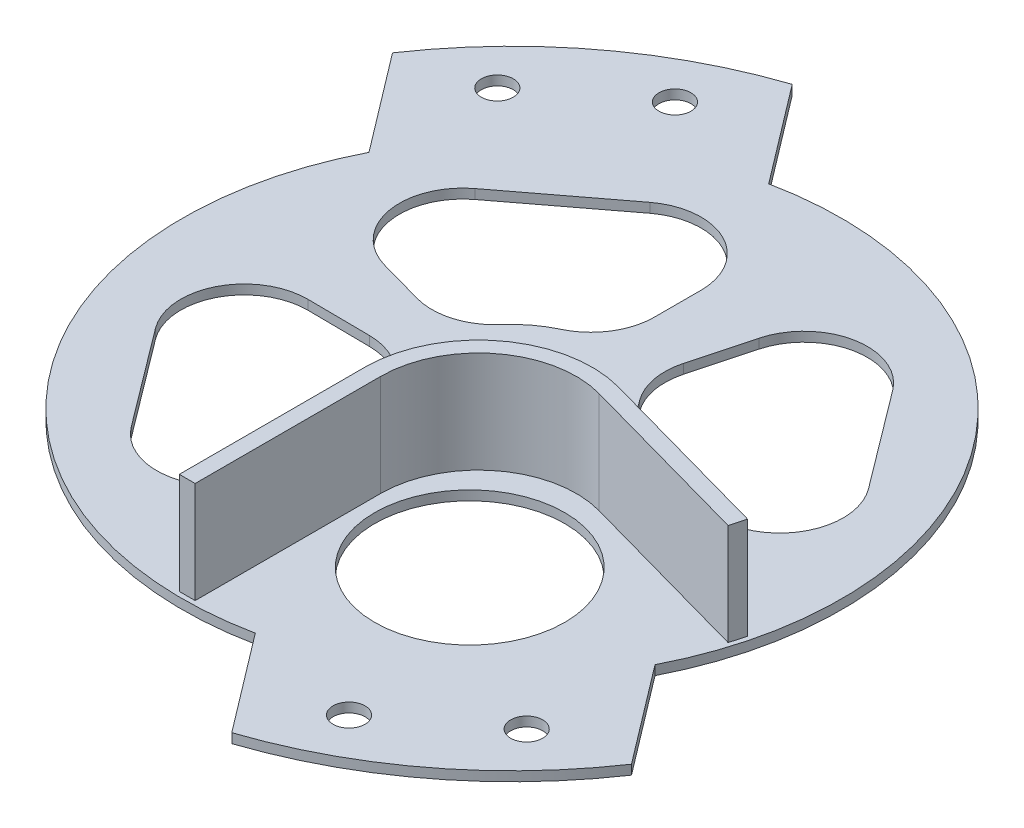
from build123d import *

# Parameters (mm, degrees)
CROQUIS1_R                    = 140
SALIENTE_EXTRUIR1_DEPTH       = 3
SALIENTE_EXTRUIR2_DEPTH       = 35
CROQUIS3_5_R                  = 30
CROQUIS3_5_R_2                = 13.2
CORTAR_EXTRUIR3_DEPTH         = 150
TALADRO_DE_MARGEN_PARA_3_81_D = 10.0838
CORTAR_EXTRUIR4_DEPTH         = 10
REDONDEO1_R                   = 20
CROQUIS7_R                    = 15
CORTAR_EXTRUIR5_DEPTH         = 3
ESCALA1_SCALE                 = 1.15


with BuildPart() as part:
    # Croquis1 → Saliente-Extruir1 (new body)
    with BuildSketch(Plane(origin=(0, 0, 0), x_dir=(1, 0, 0), z_dir=(0, 1, 0))):
        with Locations(Location((0, 0, 0), (0, 0, 270))):
            Circle(CROQUIS1_R)
    extrude(amount=SALIENTE_EXTRUIR1_DEPTH)

    # Croquis3 → Saliente-Extruir2 (add)
    with BuildSketch(Plane(origin=(0, 0, 0), x_dir=(-1, 0, 0), z_dir=(0, -1, 0))):
        with BuildLine():
            Line((2.5, -102.46950766), (-2.5, -102.46950766))
            Line((-2.5, -102.46950766), (-2.5, -43.928919859))
            ThreePointArc((-2.5, -43.928919859), (-14.696982207, -19.344018802), (-41.651497534, -14.182833045))
            Line((-41.651497534, -14.182833045), (-98.050103968, -29.873518571))
            Line((-98.050103968, -29.873518571), (-99.390258391, -25.056466971))
            Line((-99.390258391, -25.056466971), (-42.991651956, -9.365781444))
            ThreePointArc((-42.991651956, -9.365781444), (-11.672149328, -15.36276447), (2.5, -43.928919859))
            Line((2.5, -43.928919859), (2.5, -102.46950766))
        make_face()
    extrude(amount=-SALIENTE_EXTRUIR2_DEPTH)

    # Croquis3<5> → Cortar-Extruir3 (cut)
    with BuildSketch(Plane(origin=(0, 0, 0), x_dir=(-1, 0, 0), z_dir=(0, -1, 0))):
        Polygon((12.227859388, -30.111948705), (30.38932597, -97.89146473), (102.481249664, -1.960476316), (32.393429517, -2.62977644), align=None)
        with Locations(Location((-36.766027199, -50.10571417, 0), (0, 0, 90))):
            Circle(CROQUIS3_5_R)
        Polygon((-30.38932597, 97.89146473), (-102.481249664, 1.960476316), (-32.393429517, 2.62977644), (-12.227859388, 30.111948705), align=None)
        with BuildLine():
            Line((30.547985144, 11.093719108), (98.050103968, 29.873518571))
            Line((98.050103968, 29.873518571), (2.5, 102.46950766))
            Line((2.5, 102.46950766), (2.5, 32.403703492))
            ThreePointArc((2.5, 32.403703492), (19.661413711, 25.878153158), (30.547985144, 11.093719108))
        make_face()
        with Locations(Location((0, 0, 0), (0, 0, 90))):
            Circle(CROQUIS3_5_R_2)
    extrude(amount=-CORTAR_EXTRUIR3_DEPTH, mode=Mode.SUBTRACT)

    # Taladro de margen para 3/81 (through all)
    with Locations(Plane(origin=(0, 3, 0), x_dir=(1, 0, 0), z_dir=(0, 1, 0))):
        with Locations((58.047355757, -109.461018128), (89.897390413, -85.262355099), (-58.047355757, 109.461018128), (-89.897390413, 85.262355099)):
            Hole(TALADRO_DE_MARGEN_PARA_3_81_D / 2)

    # Croquis6 → Cortar-Extruir4 (cut)
    with BuildSketch(Plane(origin=(0, 3, 0), x_dir=(1, 0, 0), z_dir=(0, 1, 0))):
        with BuildLine():
            Line((-92.55315644, 47.433250289), (-138.14042031, 107.434744271))
            ThreePointArc((-138.14042031, 107.434744271), (-139.34390162, -105.869150753), (66.477842334, -161.881736087))
            Line((66.477842334, -161.881736087), (20.890578464, -101.880242105))
            ThreePointArc((20.890578464, -101.880242105), (-82.810090106, -62.916523876), (-92.55315644, 47.433250289))
        make_face()
        with BuildLine():
            Line((-66.477842334, 161.881736087), (-20.890578464, 101.880242105))
            ThreePointArc((-20.890578464, 101.880242105), (82.810090106, 62.916523876), (92.55315644, -47.433250289))
            Line((92.55315644, -47.433250289), (138.14042031, -107.434744271))
            ThreePointArc((138.14042031, -107.434744271), (139.34390162, 105.869150753), (-66.477842334, 161.881736087))
        make_face()
    extrude(amount=-CORTAR_EXTRUIR4_DEPTH, mode=Mode.SUBTRACT)

    # Redondeo1
    redondeo1_edges = [part.edges().sort_by_distance(p)[0] for p in [
        (-30.547985144, 1.5, -11.093719108),
        (-2.5, 1.5, -32.403703492),
        (-2.5, 1.5, -102.46950766),
        (-98.050103968, 1.5, -29.873518571),
        (-12.227859388, 1.5, 30.111948705),
        (-32.393429517, 1.5, 2.62977644),
        (-102.481249664, 1.5, 1.960476316),
        (-30.38932597, 1.5, 97.89146473),
        (12.227859388, 1.5, -30.111948705),
        (32.393429517, 1.5, -2.62977644),
        (102.481249664, 1.5, -1.960476316),
        (30.38932597, 1.5, -97.89146473),
    ]]
    fillet(redondeo1_edges, radius=REDONDEO1_R)

    # Croquis7 → Cortar-Extruir5 (cut)
    with BuildSketch(Plane.XZ):
        with Locations(Location((0, 0, 0), (0, 0, 270))):
            Circle(CROQUIS7_R)
    extrude(amount=-CORTAR_EXTRUIR5_DEPTH, mode=Mode.SUBTRACT)


with BuildPart() as part_1:
    # Escala1: scaled about (8.077452508, 6.145488529, 10.496326588)
    add(part.part.scale(ESCALA1_SCALE).moved(Location((-1.211617876, -0.921823279, -1.574448988))))


solid = part_1.part
